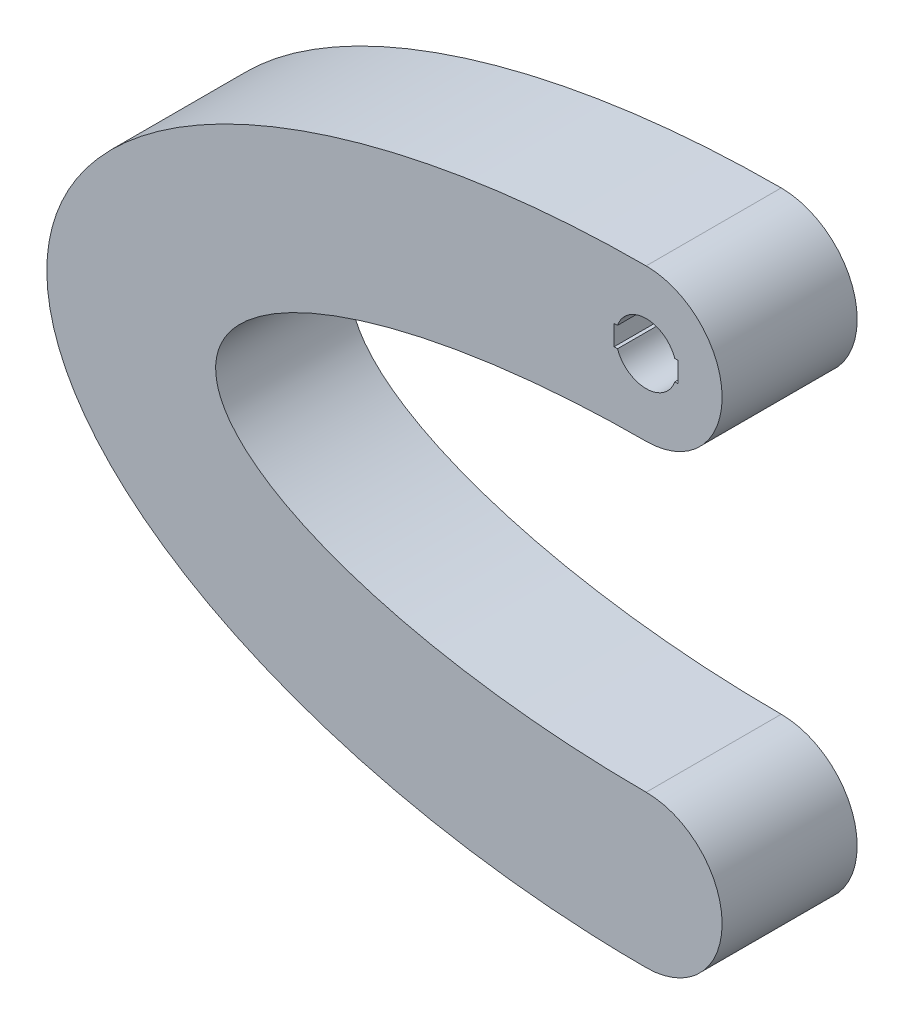
from build123d import *

# Parameters (mm, degrees)
BOSS_EXTRUDE1_DEPTH = 10
SKETCH3_R           = 2
SKETCH3_W           = 4.25
SKETCH3_H           = 1.5
CUT_EXTRUDE2_DEPTH  = 8
CUT_EXTRUDE3_DEPTH  = 36.089172283


with BuildPart() as part:
    # Sketch1 → Boss-Extrude1 (new body)
    with BuildSketch(Plane.XY):
        with BuildLine():
            ThreePointArc((19.375, 22.5), (25, 16.875), (19.375, 11.25))
            add(Edge.make_bspline(
                [(19.375, 11.25), (-12.5, 11.25), (-12.5, 0), (-12.5, -11.25), (19.375, -11.25)],
                knots=[4.71238898, 4.71238898, 4.71238898, 6.283185307, 6.283185307, 7.853981634, 7.853981634, 7.853981634], degree=2, weights=[1, 0.707106781, 1, 0.707106781, 1]))
            ThreePointArc((19.375, -11.25), (25, -16.875), (19.375, -22.5))
            add(Edge.make_bspline(
                [(19.375, 22.5), (-25, 22.5), (-25, 0), (-25, -22.5), (19.375, -22.5)],
                knots=[4.71238898, 4.71238898, 4.71238898, 6.283185307, 6.283185307, 7.853981634, 7.853981634, 7.853981634], degree=2, weights=[1, 0.707106781, 1, 0.707106781, 1]))
        make_face()
    extrude(amount=BOSS_EXTRUDE1_DEPTH)

    # Sketch3 → Cut-Extrude2 (cut)
    with BuildSketch(Plane.XY.offset(10)):
        with Locations((19.375, 16.875)):
            Circle(SKETCH3_R)
        with Locations((19.375, 16.875)):
            Rectangle(SKETCH3_W, SKETCH3_H)
    extrude(amount=-CUT_EXTRUDE2_DEPTH, mode=Mode.SUBTRACT)

    # Sketch4 → Cut-Extrude3 (cut, through all)
    with BuildSketch(Plane.XY.offset(10)):
        with BuildLine():
            Line((17.520950378, 17.625), (17.253679656, 17.625))
            ThreePointArc((17.253679656, 17.625), (17.25183335, 17.619757259), (17.25, 17.614509973))
            Line((17.25, 17.614509973), (17.25, 16.135490027))
            ThreePointArc((17.25, 16.135490027), (17.25183335, 16.130242741), (17.253679656, 16.125))
            Line((17.253679656, 16.125), (17.520950378, 16.125))
            ThreePointArc((17.520950378, 16.125), (19.375, 14.875), (21.229049622, 16.125))
            Line((21.229049622, 16.125), (21.496320344, 16.125))
            ThreePointArc((21.496320344, 16.125), (21.49816665, 16.130242741), (21.5, 16.135490027))
            Line((21.5, 16.135490027), (21.5, 17.614509973))
            ThreePointArc((21.5, 17.614509973), (21.49816665, 17.619757259), (21.496320344, 17.625))
            Line((21.496320344, 17.625), (21.229049622, 17.625))
            ThreePointArc((21.229049622, 17.625), (19.375, 18.875), (17.520950378, 17.625))
        make_face()
        Polygon((17.25, 17.614509973), (17.25, 17.625), (17, 17.625), (17, 16.125), (17.25, 16.125), (17.25, 16.135490027), align=None)
        Polygon((21.75, 17.625), (21.5, 17.625), (21.5, 17.614509973), (21.5, 16.135490027), (21.5, 16.125), (21.75, 16.125), align=None)
        with BuildLine():
            Line((17.520950378, 16.125), (17.253679656, 16.125))
            ThreePointArc((17.253679656, 16.125), (19.375, 14.625), (21.496320344, 16.125))
            Line((21.496320344, 16.125), (21.229049622, 16.125))
            ThreePointArc((21.229049622, 16.125), (19.375, 14.875), (17.520950378, 16.125))
        make_face()
        with BuildLine():
            ThreePointArc((21.496320344, 17.625), (19.375, 19.125), (17.253679656, 17.625))
            Line((17.253679656, 17.625), (17.520950378, 17.625))
            ThreePointArc((17.520950378, 17.625), (19.375, 18.875), (21.229049622, 17.625))
            Line((21.229049622, 17.625), (21.496320344, 17.625))
        make_face()
    extrude(amount=-CUT_EXTRUDE3_DEPTH, mode=Mode.SUBTRACT)


solid = part.part
